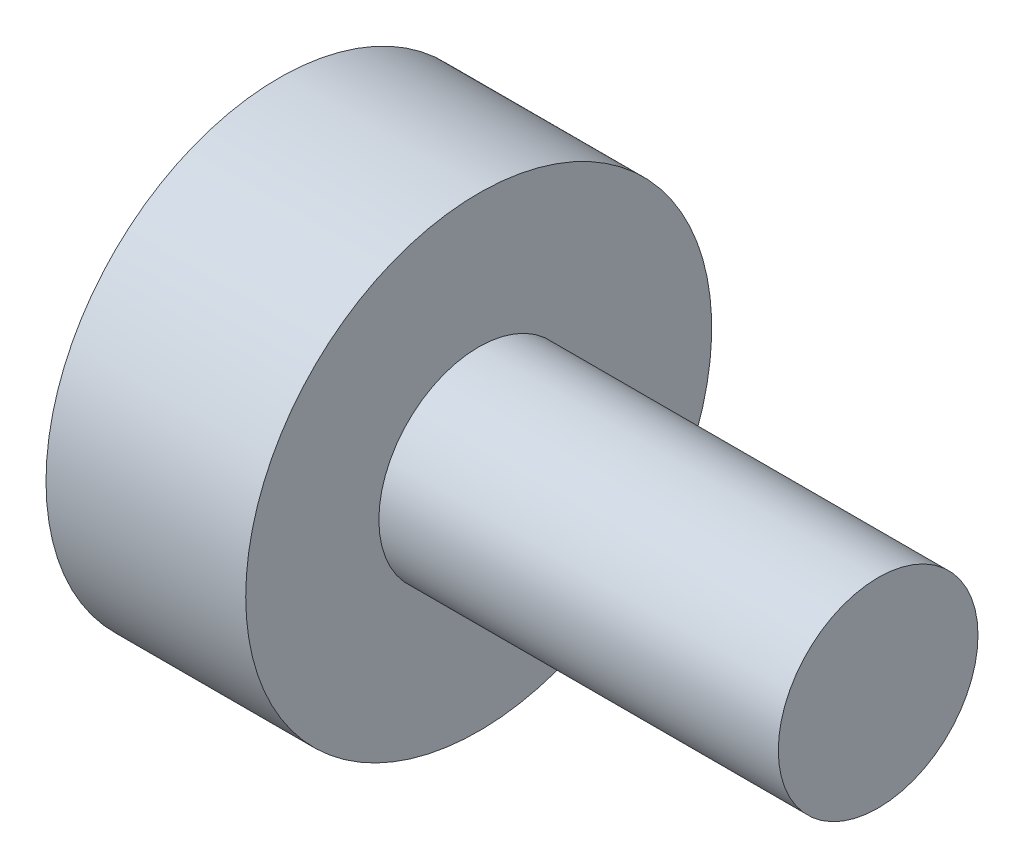
from build123d import *

# Parameters (mm, degrees)
SKETCH_2_R          = 5
CUT_EXTRUDE_1_DEPTH = 20


with BuildPart() as part:
    # Эскиз1 → Повернуть1 (revolve)
    with BuildSketch(Plane.XY, mode=Mode.PRIVATE) as revolve_1_sk:
        Polygon((0, 0), (100, 0), (100, 15), (40, 15), (40, 35), (10, 35), (10, 20), (0, 20), align=None)
    revolve(revolve_1_sk.sketch.rotate(Axis((0, 0, 0), (1, 0, 0)), 90), axis=Axis((0, 0, 0), (1, 0, 0)))

    # Эскиз2 → Вырез-Вытянуть1 (cut)
    with BuildSketch(Plane(origin=(0, 0, 0), x_dir=(0, 0, -1), z_dir=(1, 0, 0))):
        Circle(SKETCH_2_R)
    extrude(amount=CUT_EXTRUDE_1_DEPTH, mode=Mode.SUBTRACT)


solid = part.part
